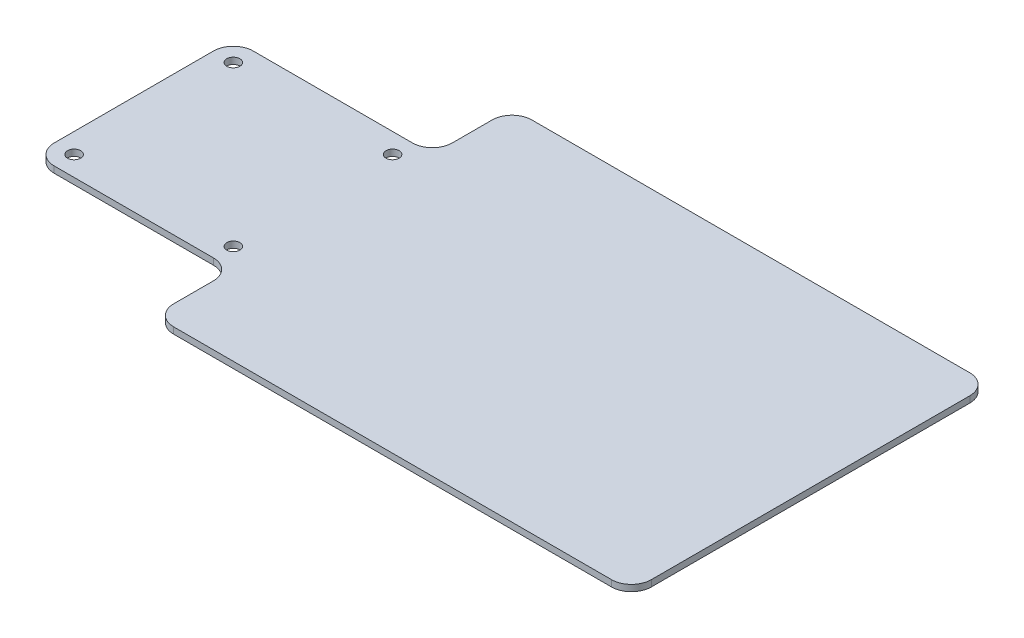
from build123d import *

# Parameters (mm, degrees)
BOSS_EXTRUDE1_DEPTH = 1.6
FILLET1_R           = 5
SKETCH2_R           = 1.65
CUT_EXTRUDE1_DEPTH  = 152.830695184


with BuildPart() as part:
    # Sketch1 → Boss-Extrude1 (new body)
    with BuildSketch(Plane(origin=(0, 0, 0), x_dir=(1, 0, 0), z_dir=(0, 1, 0))):
        Polygon((-25, 25), (25, 25), (25, 45), (145, 45), (145, -45), (25, -45), (25, -25), (-25, -25), align=None)
    extrude(amount=BOSS_EXTRUDE1_DEPTH)

    # Fillet1
    fillet1_edges = [part.edges().sort_by_distance(p)[0] for p in [
        (-25, 0.8, 25),
        (-25, 0.8, -25),
        (25, 0.8, -25),
        (25, 0.8, -45),
        (145, 0.8, -45),
        (145, 0.8, 45),
        (25, 0.8, 45),
        (25, 0.8, 25),
    ]]
    fillet(fillet1_edges, radius=FILLET1_R)

    # Sketch2 → Cut-Extrude1 (cut, through all)
    with BuildSketch(Plane(origin=(0, 1.6, 0), x_dir=(1, 0, 0), z_dir=(0, 1, 0))):
        with Locations(Location((-20, 20, 0), (0, 0, 270))):
            Circle(SKETCH2_R)
        with Locations(Location((20, 20, 0), (0, 0, 270))):
            Circle(SKETCH2_R)
        with Locations(Location((20, -20, 0), (0, 0, 270))):
            Circle(SKETCH2_R)
        with Locations(Location((-20, -20, 0), (0, 0, 270))):
            Circle(SKETCH2_R)
    extrude(amount=-CUT_EXTRUDE1_DEPTH, mode=Mode.SUBTRACT)


solid = part.part
